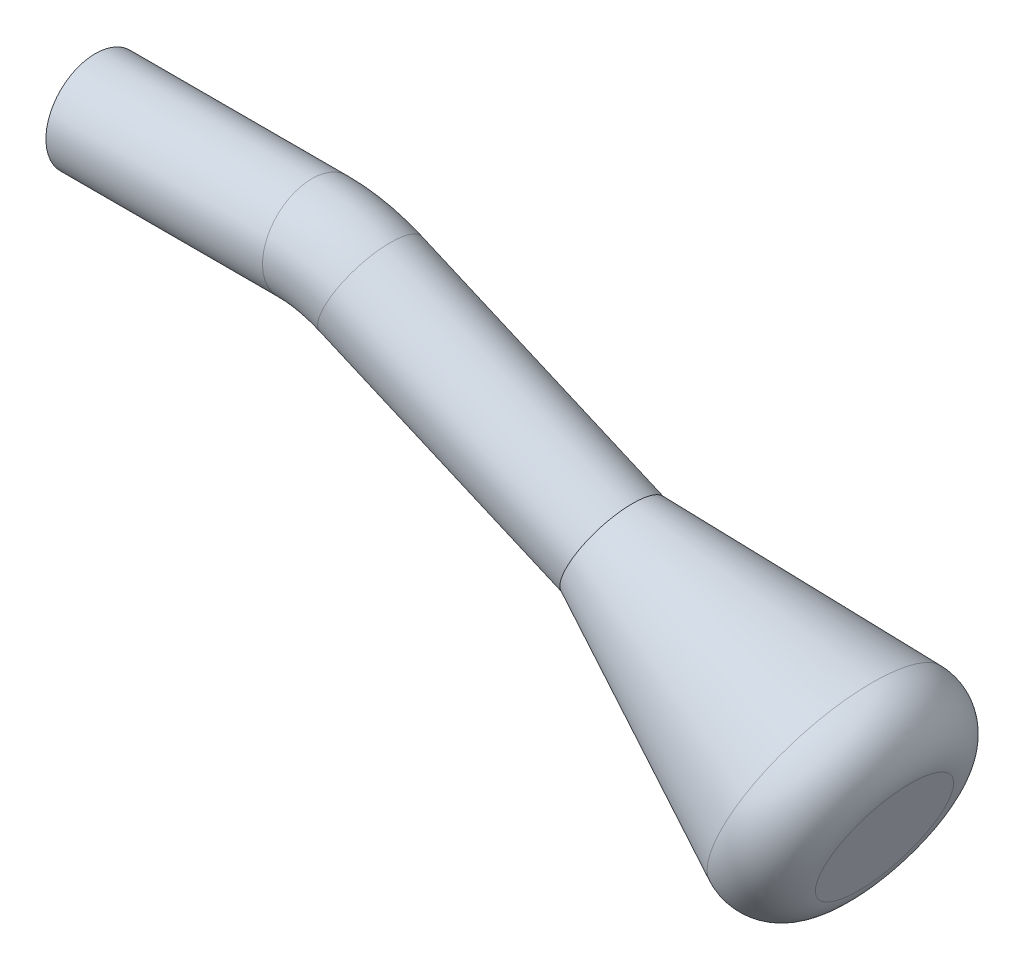
from build123d import *

# Parameters (mm, degrees)
SKETCH_2_R          = 5
SKETCH_4_OUTSIDE_W  = 29.816
SKETCH_4_OUTSIDE_H  = 82.988
SKETCH_4_OUTSIDE_R  = 3
CUT_EXTRUDE_1_DEPTH = 56.264642542
CUT_EXTRUDE_START   = -10
SKETCH_5_R          = 3
CUT_EXTRUDE_2_DEPTH = 10
SKETCH_6_R          = 5
EXTRUDE_1_DEPTH     = 30
EXTRUDE_1_DRAFT     = -15
FILLET_1_R          = 5
SKETCH_7_R          = 3
CUT_EXTRUDE_3_DEPTH = 22


with BuildPart() as part:
    # По траектории1: sweep along a path in Эскиз1
    with BuildLine(Plane.XY) as sweep_1_path:
        Line((0, 0), (21.958559609, 0))
        ThreePointArc((21.958559609, 0), (25, -0.311581421), (27.915086215, -1.233381287))
        Line((27.915086215, -1.233381287), (80, -23.7694289))
    # Эскиз2 → По траектории1 (sweep)
    with BuildSketch(Plane(origin=(0, 0, 0), x_dir=(0, 0, -1), z_dir=(1, 0, 0))):
        Circle(SKETCH_2_R)
    sweep(path=sweep_1_path.line)

    # Эскиз4 outside → Вырез-Вытянуть1 (cut, through all)
    with BuildSketch(Plane(origin=(48.514343393, -20.991136841, 0), x_dir=(0, 0, -1), z_dir=(0.9177745808471026, -0.3971017737947355, 0))):
        with Locations((0, 5.559)):
            Rectangle(SKETCH_4_OUTSIDE_W, SKETCH_4_OUTSIDE_H)
        with Locations(Location((0, 9.953164258, 0), (0, 0, 270))):
            Circle(SKETCH_4_OUTSIDE_R, mode=Mode.SUBTRACT)
    extrude(amount=CUT_EXTRUDE_1_DEPTH, mode=Mode.SUBTRACT)

    # Эскиз5 → Вырез-Вытянуть2 (cut)
    with BuildSketch(Plane(origin=(76.047580818, -32.904190055, 0), x_dir=(0, 0, -1), z_dir=(0.9177745808471026, -0.3971017737947355, 0)).offset(CUT_EXTRUDE_START)):
        with Locations(Location((0, 9.953164258, 0), (0, 0, 270))):
            Circle(SKETCH_5_R)
    extrude(amount=CUT_EXTRUDE_2_DEPTH, mode=Mode.SUBTRACT)


with BuildPart() as body_2:
    # Эскиз6 → Бобышка-Вытянуть1 (with draft: the straight prism first)
    with BuildSketch(Plane(origin=(48.514343393, -20.991136841, 0), x_dir=(0, 0, -1), z_dir=(0.9177745808471026, -0.3971017737947355, 0))):
        with Locations(Location((0, 9.953164258, 0), (0, 0, 90))):
            Circle(SKETCH_6_R)
    extrude(amount=EXTRUDE_1_DEPTH)
    # Бобышка-Вытянуть1: the draft: its side faces are tilted about the plane it starts from
    extrude_1_sides = [body_2.faces().sort_by_distance(p)[0] for p in [
        (64.247872418, -22.401775197, 0),
    ]]
    draft(extrude_1_sides, Plane(origin=(48.514343393, -20.991136841, 0), x_dir=(0, 0, -1), z_dir=(0.9177745808471026, -0.3971017737947355, 0)), EXTRUDE_1_DRAFT)

    # Скругление1
    fillet_1_edges = [body_2.edges().sort_by_distance(p)[0] for p in [
        (74.822398143, -35.735810537, 0),
    ]]
    fillet(fillet_1_edges, radius=FILLET_1_R)

    # Эскиз7 → Вырез-Вытянуть3 (cut)
    with BuildSketch(Plane(origin=(48.514343393, -20.991136841, 0), x_dir=(0, 0, 1), z_dir=(-0.9177745808471026, 0.3971017737947356, 0))):
        with Locations(Location((0, 9.953164258, 0), (0, 0, 270))):
            Circle(SKETCH_7_R)
    extrude(amount=-CUT_EXTRUDE_3_DEPTH, mode=Mode.SUBTRACT)


solid = Compound([part.part, body_2.part])
